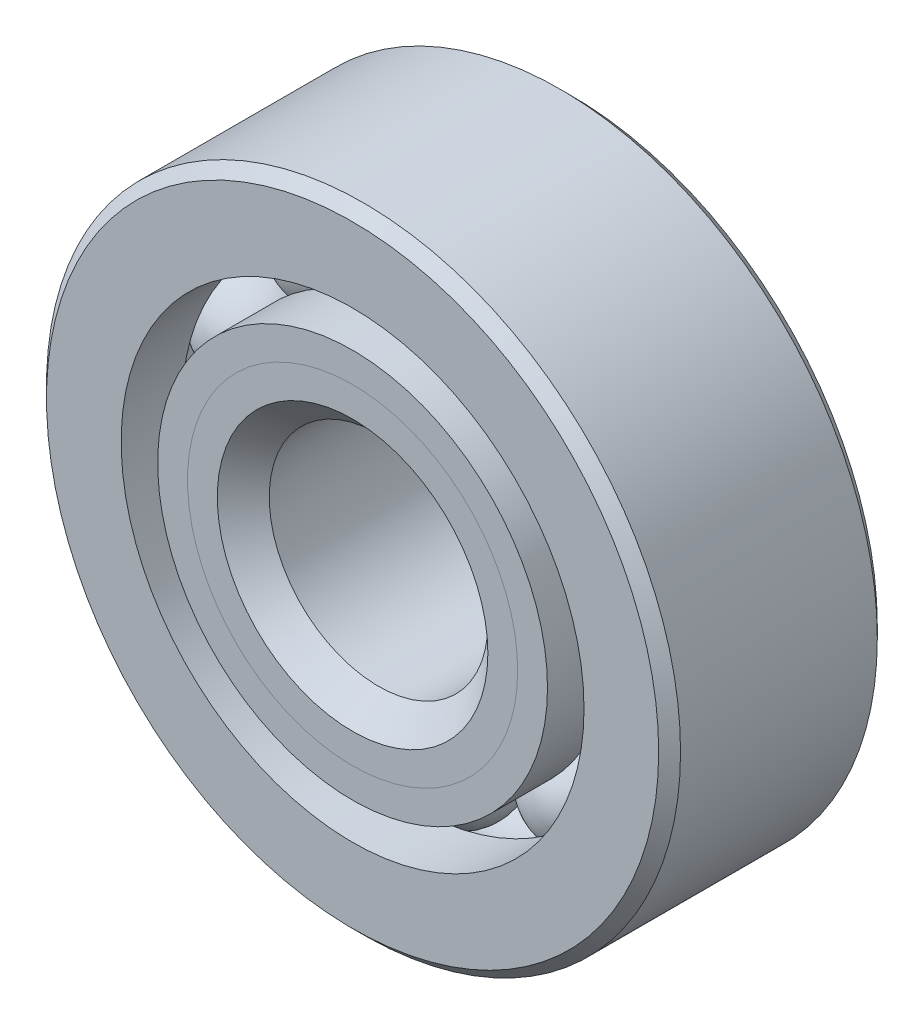
from build123d import *

# Parameters (mm, degrees)
CIRPATTERN1_COUNT = 10


with BuildPart() as part:
    # Sketch1 → Revolve1 (revolve)
    with BuildSketch(Plane(origin=(0, 0, 0), x_dir=(0, 0, -1), z_dir=(1, 0, 0))):
        with BuildLine():
            Line((3.571875, 11.509375), (-3.571875, 11.509375))
            Line((-3.571875, 11.509375), (-3.96875, 11.1125))
            Line((-3.96875, 11.1125), (-3.96875, 8.401974588))
            Line((-3.96875, 8.401974588), (-1.763888889, 8.401974588))
            ThreePointArc((-1.763888889, 8.401974588), (0, 9.623407598), (1.763888889, 8.401974588))
            Line((1.763888889, 8.401974588), (3.96875, 8.401974588))
            Line((3.96875, 8.401974588), (3.96875, 11.1125))
            Line((3.96875, 11.1125), (3.571875, 11.509375))
        make_face()
    revolve(axis=Axis((0, 0, 3.96875), (0, 0, -1)))


with BuildPart() as body_2:
    # Sketch2 → Revolve2 (revolve)
    with BuildSketch(Plane(origin=(0, 0, 0), x_dir=(0, 0, -1), z_dir=(1, 0, 0))):
        with BuildLine():
            Line((-3.96875, 7.076150412), (-1.763888889, 7.076150412))
            ThreePointArc((-1.763888889, 7.076150412), (-1.072753771, 6.189883428), (0, 5.854717402))
            Line((0, 5.854717402), (0, 4.911733701))
            Line((0, 4.911733701), (-2.886541644, 4.911733701))
            Line((-2.886541644, 4.911733701), (-3.96875, 5.993942057))
            Line((-3.96875, 5.993942057), (-3.96875, 7.076150412))
        make_face()
    revolve(axis=Axis((0, 0, 3.96875), (0, 0, -1)))


with BuildPart() as body_3:
    # Sketch3 → Revolve3 (revolve)
    with BuildSketch(Plane(origin=(0, 0, 0), x_dir=(0, 0, -1), z_dir=(1, 0, 0))):
        with BuildLine():
            Line((-3.96875, 5.993942057), (-2.886541644, 4.911733701))
            Line((-2.886541644, 4.911733701), (0, 4.911733701))
            Line((0, 4.911733701), (0, 5.854717402))
            ThreePointArc((0, 5.854717402), (1.072753771, 6.189883428), (1.763888889, 7.076150412))
            Line((1.763888889, 7.076150412), (3.96875, 7.076150412))
            Line((3.96875, 7.076150412), (3.96875, 4.365625))
            Line((3.96875, 4.365625), (3.571875, 3.96875))
            Line((3.571875, 3.96875), (-3.025766299, 3.96875))
            Line((-3.025766299, 3.96875), (-3.96875, 4.911733701))
            Line((-3.96875, 4.911733701), (-3.96875, 5.993942057))
        make_face()
    revolve(axis=Axis((0, 0, 3.96875), (0, 0, -1)))


with BuildPart() as body_4:
    # Sketch4 → Revolve4 (revolve)
    with BuildSketch(Plane(origin=(0, 0, 0), x_dir=(0, 0, -1), z_dir=(1, 0, 0))):
        with BuildLine():
            Line((-1.884345098, 7.7390625), (1.884345098, 7.7390625))
            ThreePointArc((1.884345098, 7.7390625), (0, 9.623407598), (-1.884345098, 7.7390625))
        make_face()
    revolve(axis=Axis((0, 7.7390625, 1.884345098), (0, 0, -1)))


with BuildPart() as cirpattern1_1:
    # CirPattern1: pattern copy
    add(body_4.part.rotate(Axis((0, 0, -3.96875), (0, 0, 1)), 1 * 360 / CIRPATTERN1_COUNT))


with BuildPart() as cirpattern1_2:
    # CirPattern1: pattern copy
    add(body_4.part.rotate(Axis((0, 0, -3.96875), (0, 0, 1)), 2 * 360 / CIRPATTERN1_COUNT))


with BuildPart() as cirpattern1_3:
    # CirPattern1: pattern copy
    add(body_4.part.rotate(Axis((0, 0, -3.96875), (0, 0, 1)), 3 * 360 / CIRPATTERN1_COUNT))


with BuildPart() as cirpattern1_4:
    # CirPattern1: pattern copy
    add(body_4.part.rotate(Axis((0, 0, -3.96875), (0, 0, 1)), 4 * 360 / CIRPATTERN1_COUNT))


with BuildPart() as cirpattern1_5:
    # CirPattern1: pattern copy
    add(body_4.part.rotate(Axis((0, 0, -3.96875), (0, 0, 1)), 5 * 360 / CIRPATTERN1_COUNT))


with BuildPart() as cirpattern1_6:
    # CirPattern1: pattern copy
    add(body_4.part.rotate(Axis((0, 0, -3.96875), (0, 0, 1)), 6 * 360 / CIRPATTERN1_COUNT))


with BuildPart() as cirpattern1_7:
    # CirPattern1: pattern copy
    add(body_4.part.rotate(Axis((0, 0, -3.96875), (0, 0, 1)), 7 * 360 / CIRPATTERN1_COUNT))


with BuildPart() as cirpattern1_8:
    # CirPattern1: pattern copy
    add(body_4.part.rotate(Axis((0, 0, -3.96875), (0, 0, 1)), 8 * 360 / CIRPATTERN1_COUNT))


with BuildPart() as cirpattern1_9:
    # CirPattern1: pattern copy
    add(body_4.part.rotate(Axis((0, 0, -3.96875), (0, 0, 1)), 9 * 360 / CIRPATTERN1_COUNT))


solid = Compound([part.part, body_2.part, body_3.part, body_4.part, cirpattern1_1.part, cirpattern1_2.part, cirpattern1_3.part, cirpattern1_4.part, cirpattern1_5.part, cirpattern1_6.part, cirpattern1_7.part, cirpattern1_8.part, cirpattern1_9.part])
